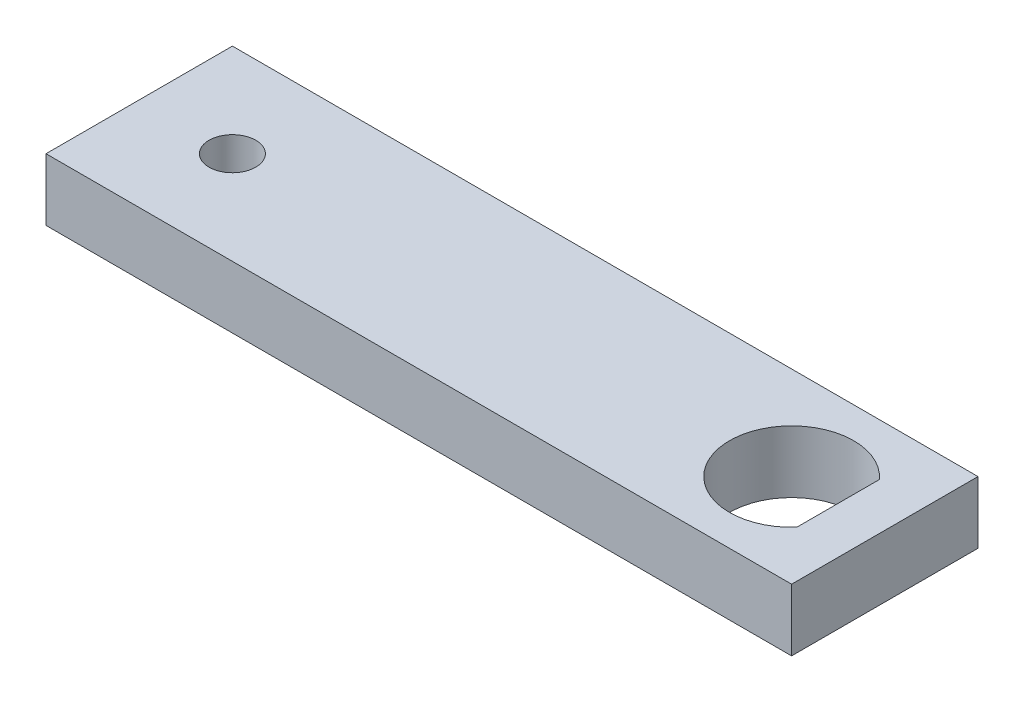
from build123d import *

# Parameters (mm, degrees)
SKETCH_1_W      = 76.2
SKETCH_1_H      = 19.05
SKETCH_1_R      = 2.3876
EXTRUDE_1_DEPTH = 6.35


with BuildPart() as part:
    # 스케치1 → 보스-돌출1 (new body)
    with BuildSketch(Plane(origin=(0, 6.35, 0), x_dir=(1, 0, 0), z_dir=(0, 1, 0))):
        with Locations((-28.575, 0)):
            Rectangle(SKETCH_1_W, SKETCH_1_H)
        with Locations(Location((-57.15, 0, 0), (0, 0, 90))):
            Circle(SKETCH_1_R, mode=Mode.SUBTRACT)
        with BuildLine():
            Line((4.7498, 4.214486915), (4.7498, -4.214486915))
            ThreePointArc((4.7498, -4.214486915), (-6.35, 0), (4.7498, 4.214486915))
        make_face(mode=Mode.SUBTRACT)
    extrude(amount=-EXTRUDE_1_DEPTH)


solid = part.part
